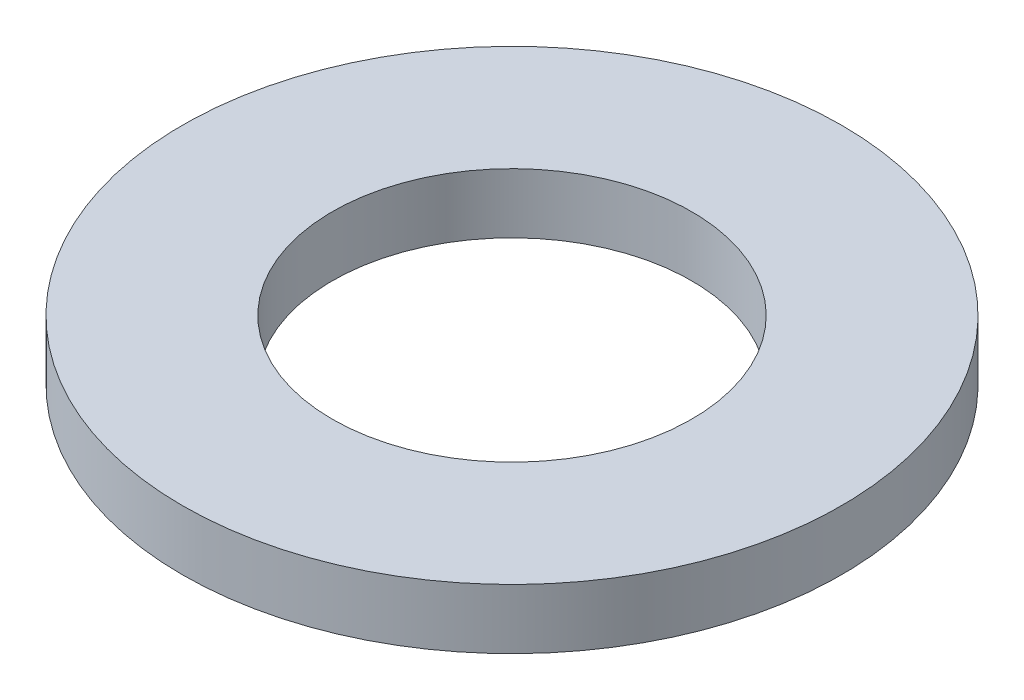
from build123d import *

# Parameters (mm, degrees)
SKETCH1_R           = 11
SKETCH1_R_2         = 6
BOSS_EXTRUDE1_DEPTH = 2


with BuildPart() as part:
    # Sketch1 → Boss-Extrude1 (new body)
    with BuildSketch(Plane(origin=(0, 0, 0), x_dir=(1, 0, 0), z_dir=(0, 1, 0))):
        with Locations(Location((0, 0, 0), (0, 0, 270))):
            Circle(SKETCH1_R)
        with Locations(Location((0, 0, 0), (0, 0, 270))):
            Circle(SKETCH1_R_2, mode=Mode.SUBTRACT)
    extrude(amount=BOSS_EXTRUDE1_DEPTH)


solid = part.part
